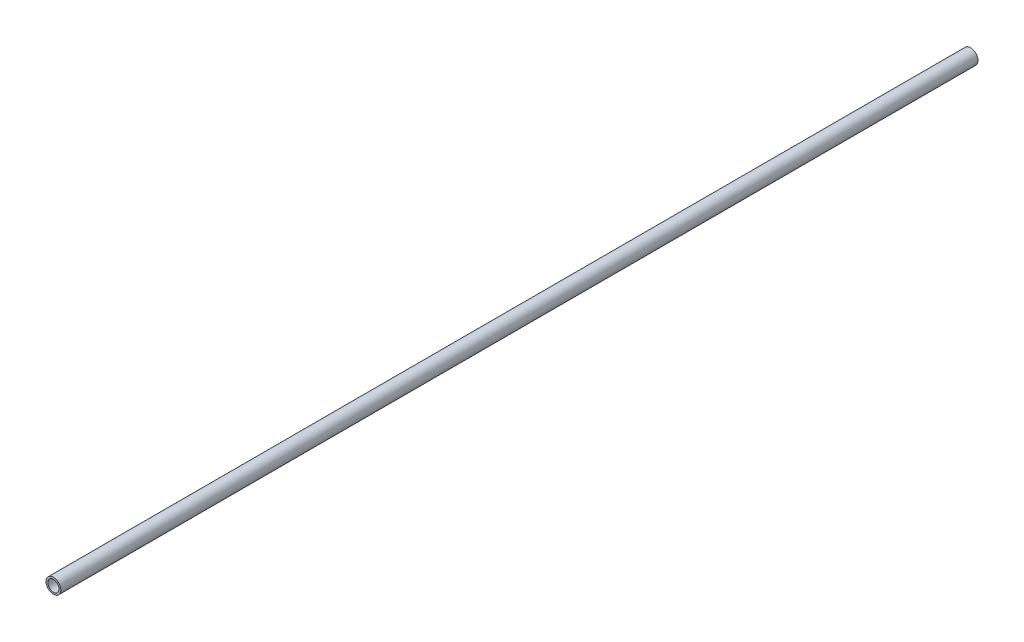
from build123d import *

# Parameters (mm, degrees)
SKETCH1_R           = 2
SKETCH1_R_2         = 1.5
BOSS_EXTRUDE1_DEPTH = 247.65


with BuildPart() as part:
    # Sketch1 → Boss-Extrude1 (new body)
    with BuildSketch(Plane.XY):
        with Locations((-6.805261823, 9.036985392)):
            Circle(SKETCH1_R)
        with Locations((-6.805261823, 9.036985392)):
            Circle(SKETCH1_R_2, mode=Mode.SUBTRACT)
    extrude(amount=BOSS_EXTRUDE1_DEPTH)


solid = part.part
